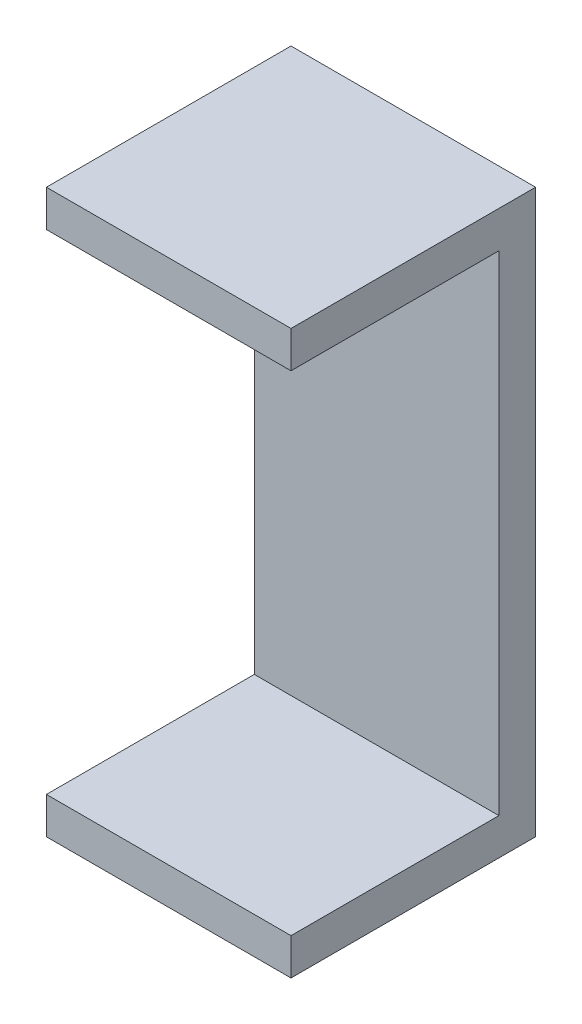
from build123d import *

# Parameters (mm, degrees)
SKETCH_1_W      = 20
SKETCH_1_H      = 40
EXTRUDE_1_DEPTH = 3
SKETCH_4_W      = 20
SKETCH_4_H      = 3
EXTRUDE_5_DEPTH = 20


with BuildPart() as part:
    # 草图1 → 凸台-拉伸1 (new body)
    with BuildSketch(Plane.XY):
        Rectangle(SKETCH_1_W, SKETCH_1_H)
    extrude(amount=EXTRUDE_1_DEPTH)

    # 草图4 → 凸台-拉伸5 (add)
    with BuildSketch(Plane(origin=(0, 0, 0), x_dir=(-1, 0, 0), z_dir=(0, 0, -1))):
        with Locations((0, 21.5)):
            Rectangle(SKETCH_4_W, SKETCH_4_H)
        with Locations((0, -21.5)):
            Rectangle(SKETCH_4_W, SKETCH_4_H)
    extrude(amount=-EXTRUDE_5_DEPTH)


solid = part.part
